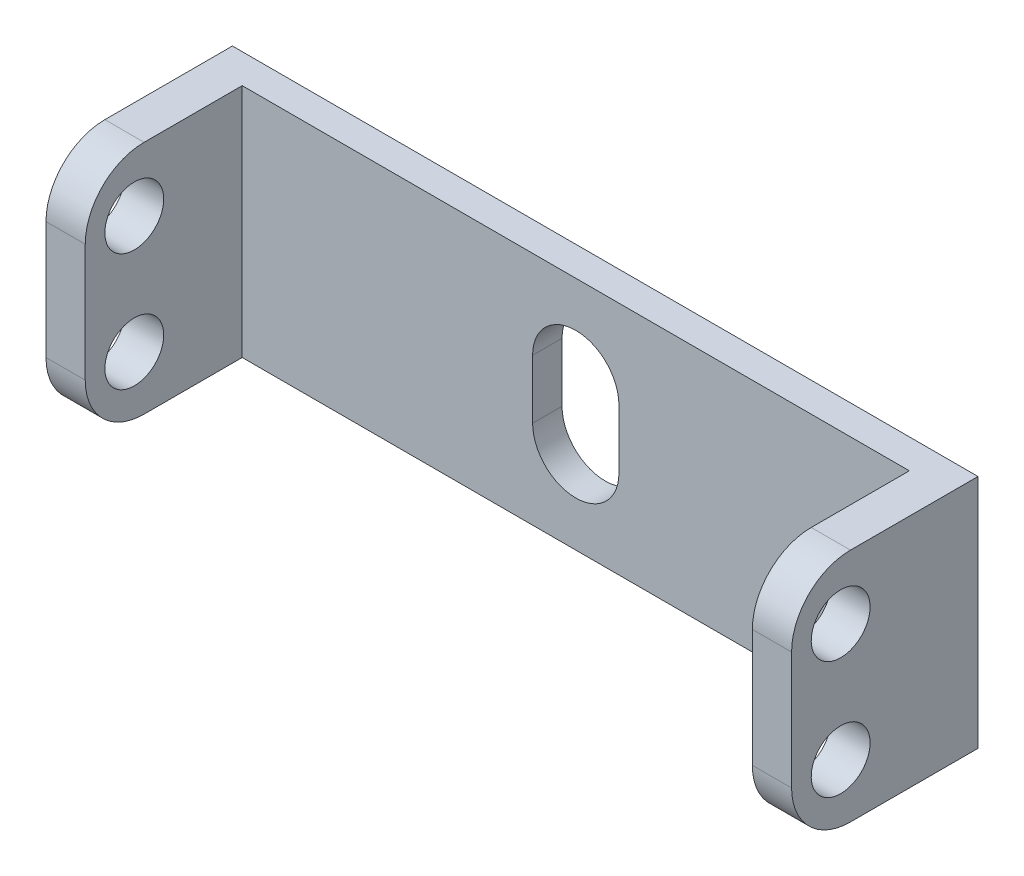
from build123d import *

# Parameters (mm, degrees)
SKETCH1_W      = 38
SKETCH1_H      = 12
EXTRUDE1_DEPTH = 1.5
SKETCH2_W      = 2
SKETCH2_H      = 12
EXTRUDE2_DEPTH = 8
EXTRUDE3_REACH = 41.626
SKETCH3_R      = 1.5
FILLET1_R      = 3
EXTRUDE4_DEPTH = 1.5


with BuildPart() as part:
    # Sketch1 → Extrude1 (new body)
    with BuildSketch(Plane.XY):
        Rectangle(SKETCH1_W, SKETCH1_H)
    extrude(amount=EXTRUDE1_DEPTH)

    # Sketch2 → Extrude2 (add)
    with BuildSketch(Plane.XY.offset(1.5)):
        with Locations((-18, 0)):
            Rectangle(SKETCH2_W, SKETCH2_H)
        with Locations((18, 0)):
            Rectangle(SKETCH2_W, SKETCH2_H)
    extrude(amount=EXTRUDE2_DEPTH)

    # Extrude3: up to this face of the body (flat: up to its plane)
    extrude3_end = Plane(part.part.faces().sort_by_distance((-19, 0, 4.75))[0])
    # Sketch3 → Extrude3 (cut, up to the picked face)
    with BuildSketch(Plane(origin=(19, 0, 0), x_dir=(0, 0, -1), z_dir=(1, 0, 0)), mode=Mode.PRIVATE) as extrude3_sk1:
        with Locations(Location((-7, 3, 0), (0, 0, 90))):
            Circle(SKETCH3_R)
    extrude3_tool1 = split(extrude(extrude3_sk1.sketch, amount=-EXTRUDE3_REACH, mode=Mode.PRIVATE), bisect_by=extrude3_end, keep=Keep.BOTH, mode=Mode.PRIVATE)
    # Sketch3 → Extrude3 (cut, up to the picked face)
    with BuildSketch(Plane(origin=(19, 0, 0), x_dir=(0, 0, -1), z_dir=(1, 0, 0)), mode=Mode.PRIVATE) as extrude3_sk2:
        with Locations(Location((-7, -3, 0), (0, 0, 90))):
            Circle(SKETCH3_R)
    extrude3_tool2 = split(extrude(extrude3_sk2.sketch, amount=-EXTRUDE3_REACH, mode=Mode.PRIVATE), bisect_by=extrude3_end, keep=Keep.BOTH, mode=Mode.PRIVATE)
    add(extrude3_tool1.solids().sort_by(Axis((19, 3, 7), (-1, 0, 0)))[0], mode=Mode.SUBTRACT)
    add(extrude3_tool2.solids().sort_by(Axis((19, -3, 7), (-1, 0, 0)))[0], mode=Mode.SUBTRACT)

    # Fillet1
    fillet1_edges = [part.edges().sort_by_distance(p)[0] for p in [
        (18, 6, 9.5),
        (18, -6, 9.5),
        (-18, -6, 9.5),
        (-18, 6, 9.5),
    ]]
    fillet(fillet1_edges, radius=FILLET1_R)

    # Sketch4 → Extrude4 (cut)
    with BuildSketch(Plane.XY.offset(1.5)):
        with BuildLine():
            Line((-2.2, 1.5), (-2.2, -1.5))
            ThreePointArc((-2.2, -1.5), (0, -3.7), (2.2, -1.5))
            Line((2.2, -1.5), (2.2, 1.5))
            ThreePointArc((2.2, 1.5), (0, 3.7), (-2.2, 1.5))
        make_face()
    extrude(amount=-EXTRUDE4_DEPTH, mode=Mode.SUBTRACT)


solid = part.part
